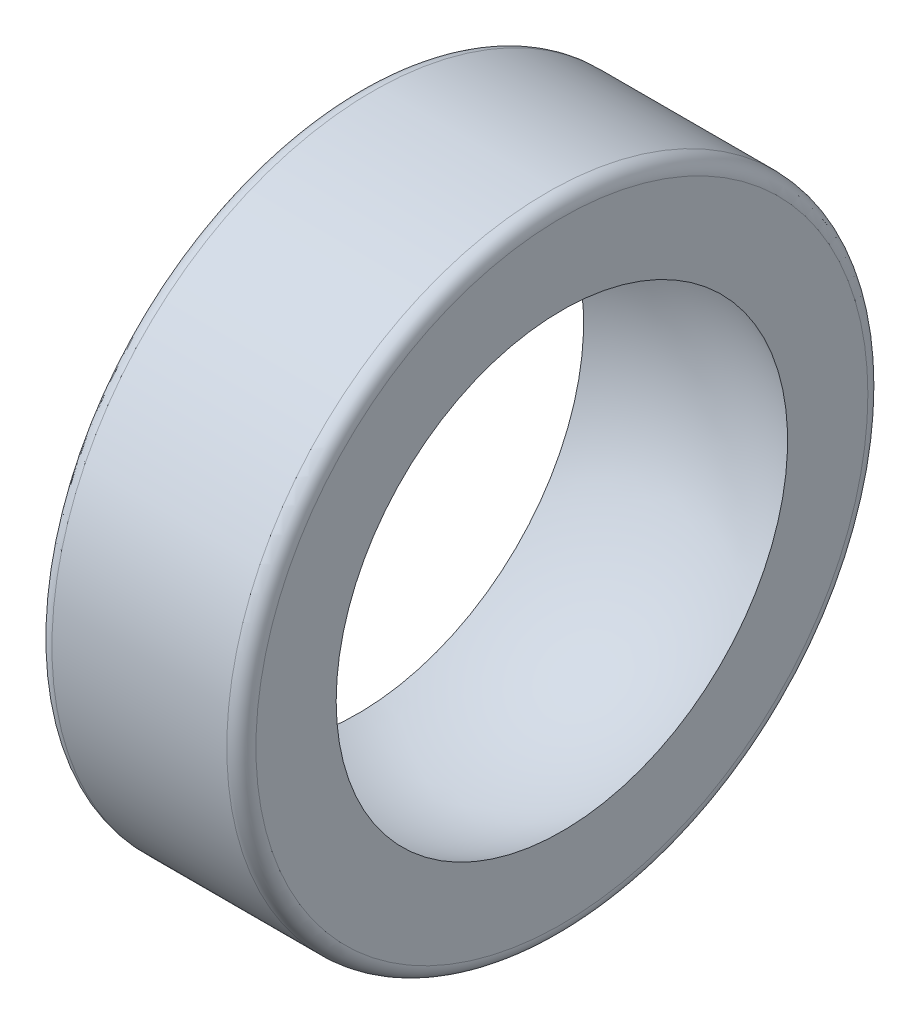
from build123d import *

# Parameters (mm, degrees)
CONG_1_R = 0.5


with BuildPart() as part:
    # Esquisse1 → Base-Révolution (revolve)
    with BuildSketch(Plane.XY, mode=Mode.PRIVATE) as base_r_volution_sk:
        with BuildLine():
            Line((-3.5, 11), (-3.5, 7.745966692))
            ThreePointArc((-3.5, 7.745966692), (0, 8.5), (3.5, 7.745966692))
            Line((3.5, 7.745966692), (3.5, 11))
            Line((3.5, 11), (-3.5, 11))
        make_face()
    revolve(base_r_volution_sk.sketch.rotate(Axis((-60, 0, 0), (1, 0, 0)), 270), axis=Axis((-60, 0, 0), (1, 0, 0)))

    # Congé1
    cong_1_edges = [part.edges().sort_by_distance(p)[0] for p in [
        (3.5, 0, 11),
        (-3.5, 0, 11),
    ]]
    fillet(cong_1_edges, radius=CONG_1_R)


solid = part.part
